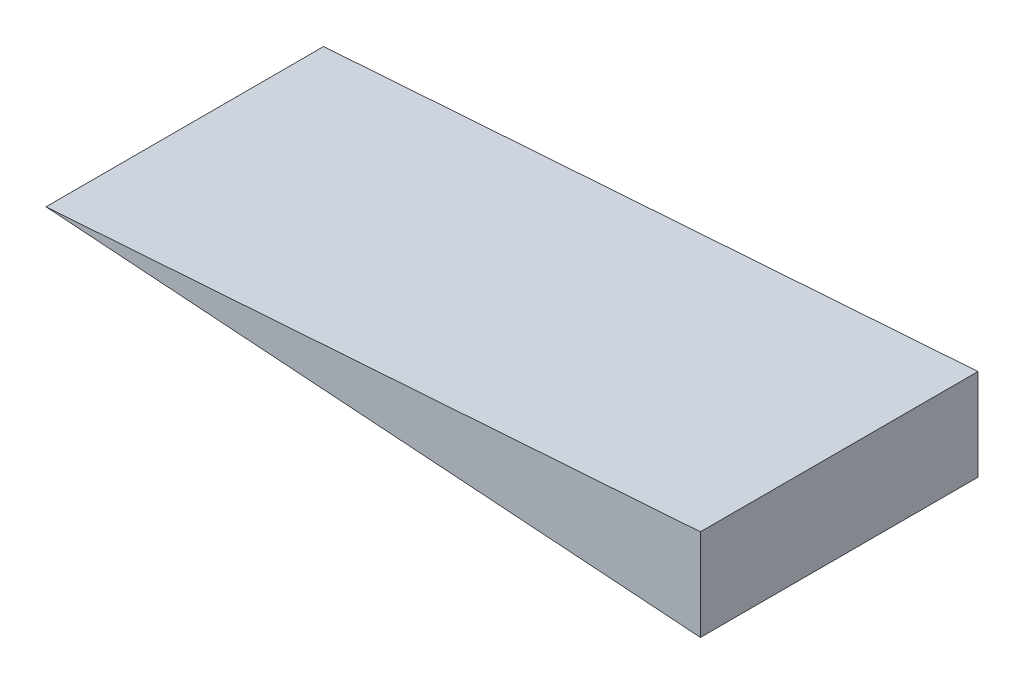
from build123d import *

# Parameters (mm, degrees)
SKETCH2_W = 236.327347182
SKETCH2_H = 100
SKETCH3_W = 236.327347182
SKETCH3_H = 100
SKETCH4_W = 100
SKETCH4_H = 32.970724778


with BuildPart() as body_1:
    # Sketch2 → Surface-Plane1: a flat surface bounded by the sketch
    with BuildSketch(Plane(origin=(-0.173966376, 2.487835086, 0), x_dir=(0.9975640502598243, 0.06975647374412548, 0), z_dir=(0.06975647374412547, -0.9975640502598242, 0)), mode=Mode.PRIVATE) as surface_plane1_1_region:
        with Locations((82.49909721, 0)):
            Rectangle(SKETCH2_W, SKETCH2_H)
    surface_plane1_1 = surface_plane1_1_region.sketch.faces()[0]
    # Sketch7 → Surface-Plane3: a flat surface bounded by the sketch
    with BuildSketch(Plane.XY.offset(50), mode=Mode.PRIVATE) as surface_plane3_2_region:
        Polygon((-35.751665642, 0), (200, 16.485362389), (200, -16.485362389), align=None)
    surface_plane3_2 = surface_plane3_2_region.sketch.faces()[0]
    # Sketch3 → Surface-Plane2: a flat surface bounded by the sketch
    with BuildSketch(Plane(origin=(-0.173966376, -2.487835086, 0), x_dir=(0.9975640502598243, -0.06975647374412548, 0), z_dir=(-0.06975647374412547, -0.9975640502598242, 0)), mode=Mode.PRIVATE) as surface_plane2_3_region:
        with Locations((82.49909721, 0)):
            Rectangle(SKETCH3_W, SKETCH3_H)
    surface_plane2_3 = surface_plane2_3_region.sketch.faces()[0]
    # Sketch4 → Surface-Plane4: a flat surface bounded by the sketch
    with BuildSketch(Plane(origin=(200, 0, 0), x_dir=(0, 0, -1), z_dir=(1, 0, 0)), mode=Mode.PRIVATE) as surface_plane4_4_region:
        Rectangle(SKETCH4_W, SKETCH4_H)
    surface_plane4_4 = surface_plane4_4_region.sketch.faces()[0]
    # Sketch5 → Surface-Plane5: a flat surface bounded by the sketch
    with BuildSketch(Plane.XY.offset(-50), mode=Mode.PRIVATE) as surface_plane5_5_region:
        Polygon((-35.751665642, 0), (200, 16.485362389), (200, -16.485362389), align=None)
    surface_plane5_5 = surface_plane5_5_region.sketch.faces()[0]
    # Surface-Knit1: the surfaces knitted into a closed skin and filled: a solid
    add(Solid(Shell(Face.sew_faces(surface_plane1_1.faces() + surface_plane3_2.faces() + surface_plane2_3.faces() + surface_plane4_4.faces() + surface_plane5_5.faces())[0])))


solid = body_1.part
